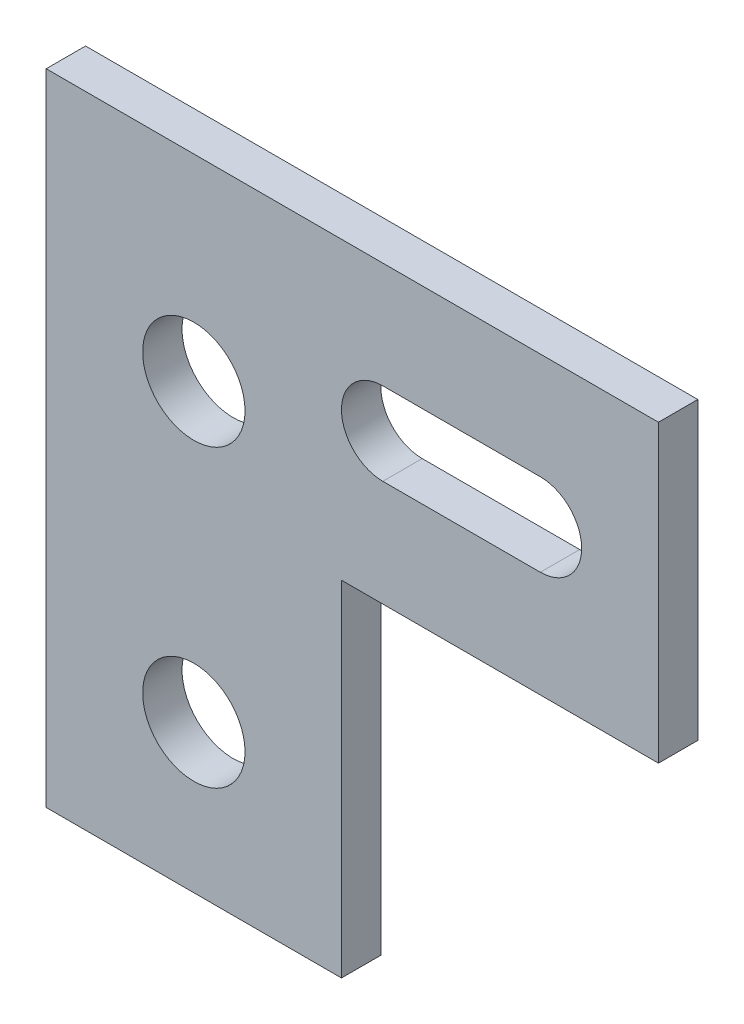
from build123d import *

# Parameters (mm, degrees)
SKETCH_1_R      = 2.6
SKETCH_1_W      = 15
SKETCH_1_H      = 15
EXTRUDE_1_DEPTH = 2


with BuildPart() as part:
    # 草图1 → 凸台-拉伸1 (new body)
    # profile 1 of 2: a face of its own
    with BuildSketch(Plane.XY):
        Polygon((0, 17.5), (0, 0), (15, 0), (15, 2.5), (31.1, 2.5), (31.1, 17.5), align=None)
        with Locations((7.5, 7.5)):
            Circle(SKETCH_1_R, mode=Mode.SUBTRACT)
        with BuildLine():
            ThreePointArc((17.1, 7.9), (15, 10), (17.1, 12.1))
            Line((17.1, 12.1), (25.1, 12.1))
            ThreePointArc((25.1, 12.1), (27.2, 10), (25.1, 7.9))
            Line((25.1, 7.9), (17.1, 7.9))
        make_face(mode=Mode.SUBTRACT)
    # profile 2 of 2: a face of its own
    with BuildSketch(Plane.XY):
        with Locations((7.5, -7.5)):
            Rectangle(SKETCH_1_W, SKETCH_1_H)
        with Locations((7.5, -7.5)):
            Circle(SKETCH_1_R, mode=Mode.SUBTRACT)
    extrude(amount=EXTRUDE_1_DEPTH)


solid = part.part
